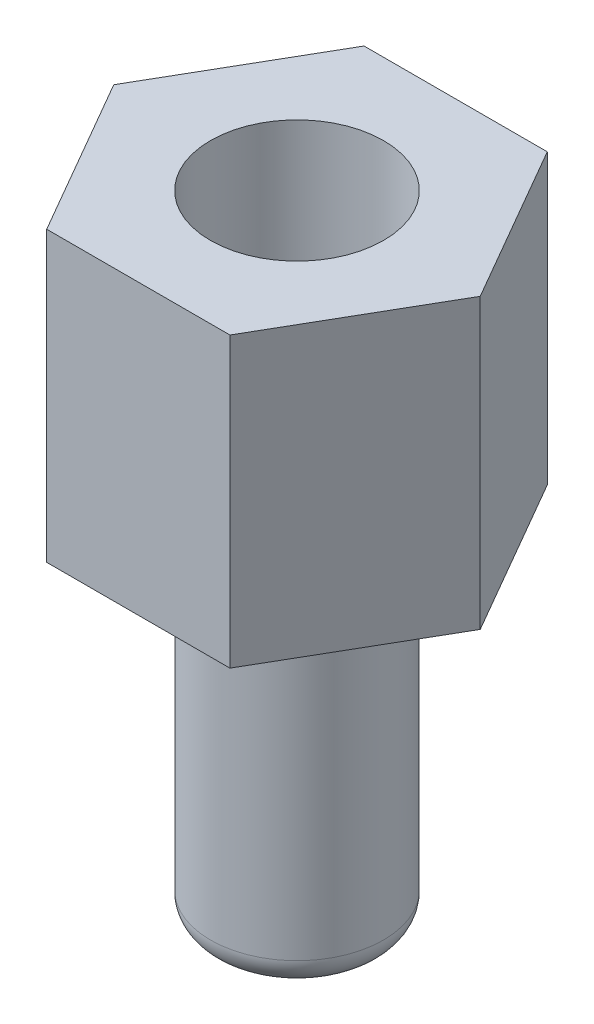
from build123d import *

# Parameters (mm, degrees)
BOSS_EXTRUDE1_DEPTH = 5
SKETCH2_R           = 1.5
BOSS_EXTRUDE2_DEPTH = 6
FILLET1_R           = 0.5
SKETCH3_R           = 1.5
CUT_EXTRUDE1_DEPTH  = 2.5


with BuildPart() as part:
    # Sketch1 → Boss-Extrude1 (new body)
    with BuildSketch(Plane(origin=(0, 0, 0), x_dir=(1, 0, 0), z_dir=(0, 1, 0))):
        Polygon((3.175426481, 0), (1.58771324, 2.75), (-1.58771324, 2.75), (-3.175426481, 0), (-1.58771324, -2.75), (1.58771324, -2.75), align=None)
    extrude(amount=BOSS_EXTRUDE1_DEPTH)

    # Sketch2 → Boss-Extrude2 (add)
    with BuildSketch(Plane.XZ):
        with Locations(Location((0, 0, 0), (0, 0, 90))):
            Circle(SKETCH2_R)
    extrude(amount=BOSS_EXTRUDE2_DEPTH)

    # Fillet1
    fillet1_edges = [part.edges().sort_by_distance(p)[0] for p in [
        (0, -6, -1.5),
    ]]
    fillet(fillet1_edges, radius=FILLET1_R)

    # Sketch3 → Cut-Extrude1 (cut)
    with BuildSketch(Plane(origin=(0, 5, 0), x_dir=(1, 0, 0), z_dir=(0, 1, 0))):
        with Locations(Location((0, 0, 0), (0, 0, 270))):
            Circle(SKETCH3_R)
    extrude(amount=-CUT_EXTRUDE1_DEPTH, mode=Mode.SUBTRACT)


solid = part.part
